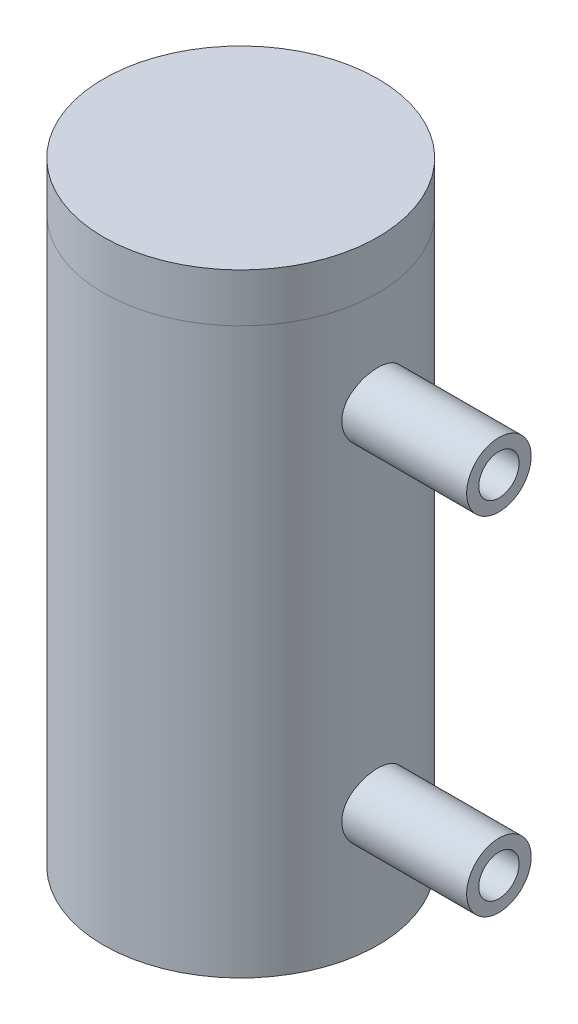
from build123d import *

# Parameters (mm, degrees)
SLEEVE_START        = 410
SKETCH1_R           = 17
SLEEVE_DEPTH        = 70
BORE_START          = 409
SKETCH2_R           = 15
BORE_DEPTH          = 72
CAP_START           = 480
SKETCH3_R           = 17
CAP_DEPTH           = 6
SPIGOT_425_START    = 44.5
SKETCH4_R           = 4
SPIGOT_425_DEPTH    = 16.5
SPIGOT_BORE_START   = 44
SKETCH5_R           = 2.5
SPIGOT_BORE_DEPTH   = 18
SPIGOT_468_START    = 44.5
SKETCH6_R           = 4
SPIGOT_468_DEPTH    = 16.5
BOSS_EXTRUDE7_START = 44
SKETCH7_R           = 2.5
BOSS_EXTRUDE7_DEPTH = 18


with BuildPart() as part:
    # Sketch1 → sleeve (new body)
    with BuildSketch(Plane(origin=(0, 0, 0), x_dir=(1, 0, 0), z_dir=(0, 1, 0)).offset(SLEEVE_START)):
        with Locations((29, -498)):
            Circle(SKETCH1_R)
    extrude(amount=SLEEVE_DEPTH)


with BuildPart() as body_2:
    # Sketch2 → bore (new body)
    with BuildSketch(Plane(origin=(0, 0, 0), x_dir=(1, 0, 0), z_dir=(0, 1, 0)).offset(BORE_START)):
        with Locations((29, -498)):
            Circle(SKETCH2_R)
    extrude(amount=BORE_DEPTH)


with BuildPart() as part_1:
    add(part.part)

    # Combine1: cut body 2
    add(body_2.part, mode=Mode.SUBTRACT)


with BuildPart() as body_2_2:
    # Sketch3 → cap (new body)
    with BuildSketch(Plane(origin=(0, 0, 0), x_dir=(1, 0, 0), z_dir=(0, 1, 0)).offset(CAP_START)):
        with Locations((29, -498)):
            Circle(SKETCH3_R)
    extrude(amount=CAP_DEPTH)


with BuildPart() as body_3:
    # Sketch4 → spigot_425 (new body)
    with BuildSketch(Plane(origin=(0, 0, 0), x_dir=(0, 0, -1), z_dir=(1, 0, 0)).offset(SPIGOT_425_START)):
        with Locations((-498, 425)):
            Circle(SKETCH4_R)
    extrude(amount=SPIGOT_425_DEPTH)


with BuildPart() as body_4:
    # Sketch5 → spigot_bore (new body)
    with BuildSketch(Plane(origin=(0, 0, 0), x_dir=(0, 0, -1), z_dir=(1, 0, 0)).offset(SPIGOT_BORE_START)):
        with Locations((-498, 425)):
            Circle(SKETCH5_R)
    extrude(amount=SPIGOT_BORE_DEPTH)


with BuildPart() as body_3_1:
    add(body_3.part)

    # Combine2: cut body 4
    add(body_4.part, mode=Mode.SUBTRACT)


with BuildPart() as body_4_2:
    # Sketch6 → spigot_468 (new body)
    with BuildSketch(Plane(origin=(0, 0, 0), x_dir=(0, 0, -1), z_dir=(1, 0, 0)).offset(SPIGOT_468_START)):
        with Locations((-498, 468)):
            Circle(SKETCH6_R)
    extrude(amount=SPIGOT_468_DEPTH)


with BuildPart() as body_5:
    # Sketch7 → Boss-Extrude7 (new body)
    with BuildSketch(Plane(origin=(0, 0, 0), x_dir=(0, 0, -1), z_dir=(1, 0, 0)).offset(BOSS_EXTRUDE7_START)):
        with Locations((-498, 468)):
            Circle(SKETCH7_R)
    extrude(amount=BOSS_EXTRUDE7_DEPTH)


with BuildPart() as body_4_2_1:
    add(body_4_2.part)

    # Combine3: cut body 5
    add(body_5.part, mode=Mode.SUBTRACT)


solid = Compound([part_1.part, body_2_2.part, body_3_1.part, body_4_2_1.part])
